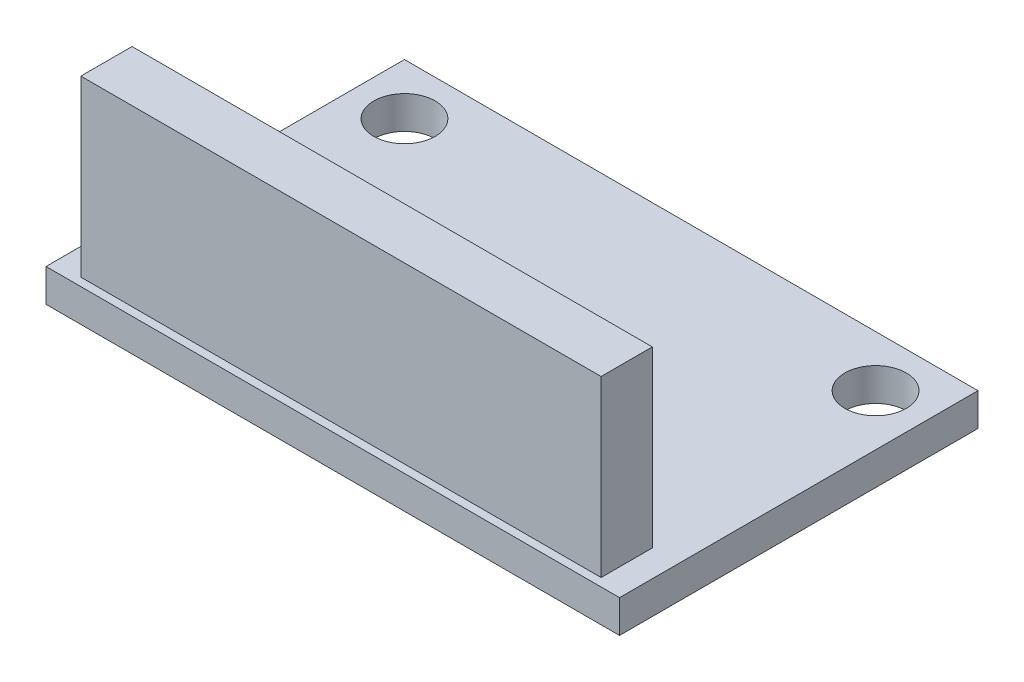
from build123d import *

# Parameters (mm, degrees)
SKETCH1_W               = 28
SKETCH1_H               = 17.5
PCB_DEPTH               = 1.6
MOUNT_HOLE_1_DEPTH      = 34.057676869
MOUNT_HOLE_1_DEPTH_BACK = 34.057676869
SKETCH2_R               = 1.5
MOUNT_HOLE_2_DEPTH      = 34.057676869
MOUNT_HOLE_2_DEPTH_BACK = 34.057676869
SKETCH3_R               = 1.5
HEADER_10PIN_START      = 1.6
SKETCH4_W               = 25.4
SKETCH4_H               = 2.5
HEADER_10PIN_DEPTH      = 8.5
ADS1115_IC_START        = 1.6
SKETCH5_W               = 5
SKETCH5_H               = 3
ADS1115_IC_DEPTH        = 1
CAPS_START              = 1.6
SKETCH6_W               = 2
SKETCH6_H               = 1.2
CAPS_DEPTH              = 0.8


with BuildPart() as part:
    # Sketch1 → PCB (new body)
    with BuildSketch(Plane(origin=(0, 0, 0), x_dir=(1, 0, 0), z_dir=(0, 1, 0))):
        with Locations((14, 8.75)):
            Rectangle(SKETCH1_W, SKETCH1_H)
    extrude(amount=PCB_DEPTH)

    # Sketch2 → Mount_hole_1 (cut, two sides: drawn at the far end of the back side and taken through both)
    with BuildSketch(Plane(origin=(0, 0, 0), x_dir=(1, 0, 0), z_dir=(0, 1, 0)).offset(-MOUNT_HOLE_1_DEPTH_BACK)):
        with Locations(Location((2.5, 15, 0), (0, 0, 270))):
            Circle(SKETCH2_R)
    extrude(amount=MOUNT_HOLE_1_DEPTH + MOUNT_HOLE_1_DEPTH_BACK, mode=Mode.SUBTRACT)

    # Sketch3 → Mount_hole_2 (cut, two sides: drawn at the far end of the back side and taken through both)
    with BuildSketch(Plane(origin=(0, 0, 0), x_dir=(1, 0, 0), z_dir=(0, 1, 0)).offset(-MOUNT_HOLE_2_DEPTH_BACK)):
        with Locations(Location((25.5, 15, 0), (0, 0, 270))):
            Circle(SKETCH3_R)
    extrude(amount=MOUNT_HOLE_2_DEPTH + MOUNT_HOLE_2_DEPTH_BACK, mode=Mode.SUBTRACT)

    # Sketch4 → Header_10pin (add)
    with BuildSketch(Plane(origin=(0, 0, 0), x_dir=(1, 0, 0), z_dir=(0, 1, 0)).offset(HEADER_10PIN_START)):
        with Locations((14, 1.65)):
            Rectangle(SKETCH4_W, SKETCH4_H)
    extrude(amount=HEADER_10PIN_DEPTH)

    # Sketch5 → ADS1115_IC (add)
    with BuildSketch(Plane(origin=(0, 0, 0), x_dir=(1, 0, 0), z_dir=(0, 1, 0)).offset(ADS1115_IC_START)):
        with Locations((13.5, 8)):
            Rectangle(SKETCH5_W, SKETCH5_H)
    extrude(amount=ADS1115_IC_DEPTH)

    # Sketch6 → Caps (add)
    with BuildSketch(Plane(origin=(0, 0, 0), x_dir=(1, 0, 0), z_dir=(0, 1, 0)).offset(CAPS_START)):
        with Locations((18.5, 7.1)):
            Rectangle(SKETCH6_W, SKETCH6_H)
    extrude(amount=CAPS_DEPTH)


solid = part.part
